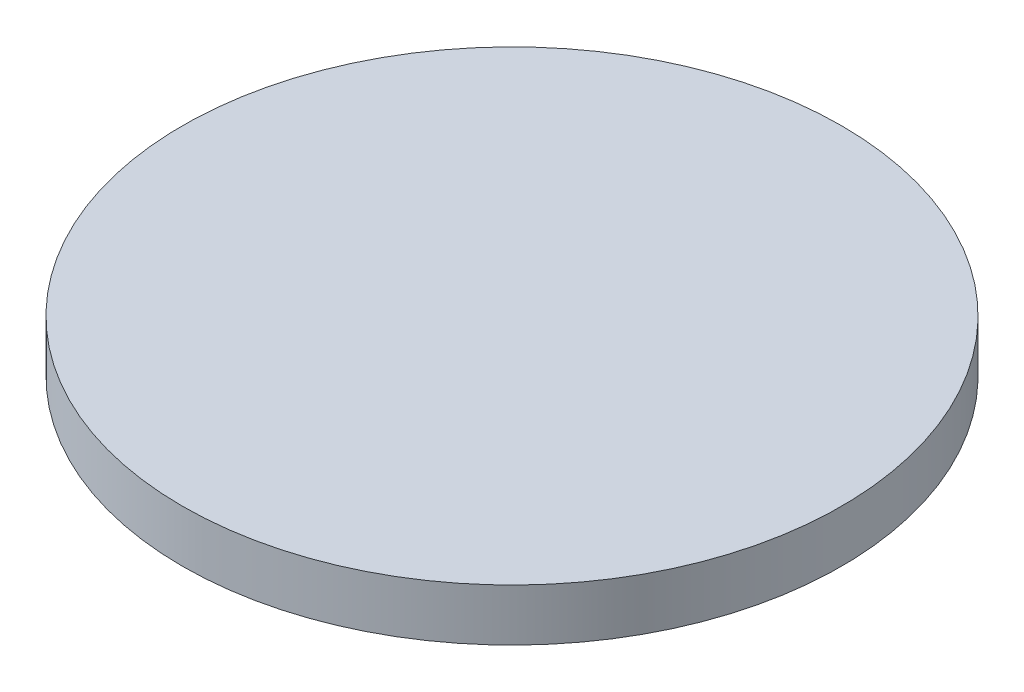
from build123d import *

# Parameters (mm, degrees)
SKETCH1_R           = 19
BOSS_EXTRUDE1_DEPTH = 3


with BuildPart() as part:
    # Sketch1 → Boss-Extrude1 (new body)
    with BuildSketch(Plane(origin=(0, 0, 0), x_dir=(1, 0, 0), z_dir=(0, 1, 0))):
        with Locations(Location((0, 0, 0), (0, 0, 270))):
            Circle(SKETCH1_R)
    extrude(amount=BOSS_EXTRUDE1_DEPTH)


solid = part.part
